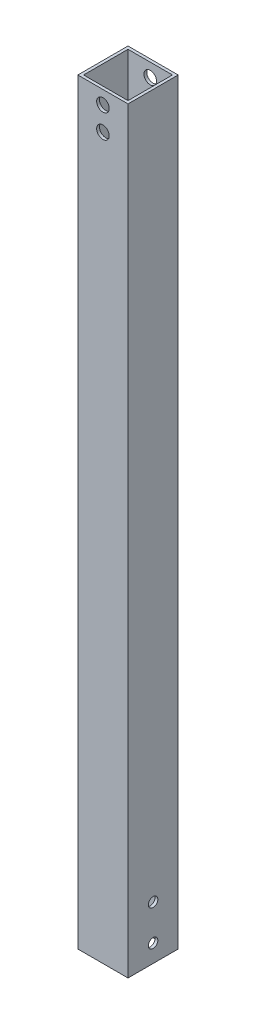
from build123d import *

# Parameters (mm, degrees)
SKETCH1_W               = 26.924
SKETCH1_H               = 26.924
SKETCH1_W_2             = 23.876
SKETCH1_H_2             = 23.876
EXTRUDE_THIN1_DEPTH     = 406.4
F_1_4_CLEARANCE_HOLE1_D = 6.7564
F_10_CLEARANCE_HOLE1_D  = 5.1054


with BuildPart() as part:
    # Sketch1 → Extrude-Thin1 (new body)
    with BuildSketch(Plane(origin=(0, 0, 0), x_dir=(1, 0, 0), z_dir=(0, 1, 0))):
        Rectangle(SKETCH1_W, SKETCH1_H)
        Rectangle(SKETCH1_W_2, SKETCH1_H_2, mode=Mode.SUBTRACT)
    extrude(amount=EXTRUDE_THIN1_DEPTH)

    # 1/4 Clearance Hole1 (through all)
    with Locations(Plane(origin=(0, 0, -13.462), x_dir=(-1, 0, 0), z_dir=(0, 0, -1))):
        with Locations((0, 399.2245), (0, 386.5245)):
            Hole(F_1_4_CLEARANCE_HOLE1_D / 2)

    # #10 Clearance Hole1 (through all)
    with Locations(Plane(origin=(13.462, 0, 0), x_dir=(0, 0, -1), z_dir=(1, 0, 0))):
        with Locations((0, 9.525), (0, 28.575)):
            Hole(F_10_CLEARANCE_HOLE1_D / 2)


solid = part.part
